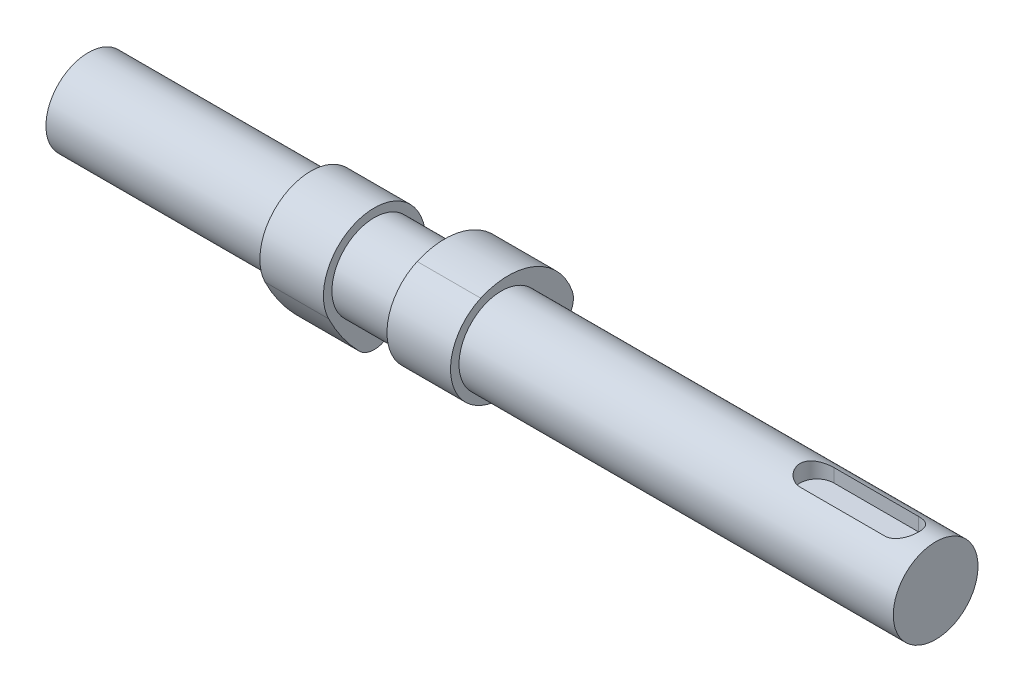
from build123d import *

# Parameters (mm, degrees)
BOSS_EXTRUDE1_DEPTH      = 125
BOSS_EXTRUDE1_DEPTH_BACK = 75
SKETCH1_R                = 10
BOSS_EXTRUDE2_START      = 15
BOSS_EXTRUDE2_DEPTH      = 7.5
BODY_MOVE_COPY1_ANGLE    = 90
CUT_EXTRUDE1_DEPTH       = 4


with BuildPart() as part:
    # Sketch1 → Boss-Extrude1 (new, two sides: drawn at the far end of the back side and taken through both)
    with BuildSketch(Plane(origin=(0, 0, 0), x_dir=(0, 0, -1), z_dir=(1, 0, 0)).offset(-BOSS_EXTRUDE1_DEPTH_BACK)):
        Circle(SKETCH1_R)
    extrude(amount=BOSS_EXTRUDE1_DEPTH + BOSS_EXTRUDE1_DEPTH_BACK)

    # Sketch3 → Cut-Extrude1 (cut)
    with BuildSketch(Plane(origin=(0, 10, 0), x_dir=(1, 0, 0), z_dir=(0, 1, 0))):
        with BuildLine():
            Line((97, 4), (117, 4))
            ThreePointArc((117, 4), (121, 0), (117, -4))
            Line((117, -4), (97, -4))
            ThreePointArc((97, -4), (93, 0), (97, 4))
        make_face()
    extrude(amount=-CUT_EXTRUDE1_DEPTH, mode=Mode.SUBTRACT)


with BuildPart() as body_2:
    # Sketch2 → Boss-Extrude2 (new, symmetric)
    with BuildSketch(Plane(origin=(0, 0, 0), x_dir=(0, 0, -1), z_dir=(1, 0, 0)).offset(BOSS_EXTRUDE2_START)):
        with BuildLine():
            ThreePointArc((-4.867089568, 10.968657125), (-10.868088345, -5.087696504), (5.306226617, -10.763083159))
            ThreePointArc((5.306226617, -10.763083159), (10.673744978, -7.573594418), (15.479542802, -3.587694386))
            ThreePointArc((15.479542802, -3.587694386), (16.864464688, -1.143374761), (16.712672037, 1.661917746))
            ThreePointArc((16.712672037, 1.661917746), (7.958571112, 11.035699457), (-4.867089568, 10.968657125))
        make_face()
    extrude(amount=BOSS_EXTRUDE2_DEPTH, both=True)


with BuildPart() as body_3:
    # Mirror5: mirrored copy
    add(body_2.part.mirror(Plane(origin=(0, 0, 0), x_dir=(0, 0, 1), z_dir=(1, 0, 0))))


with BuildPart() as body_3_1:
    # Body-Move/Copy1: moved
    add(body_3.part.rotate(Axis((0, 0, 0), (-1, 0, 0)), BODY_MOVE_COPY1_ANGLE))


solid = Compound([part.part, body_2.part, body_3_1.part])
